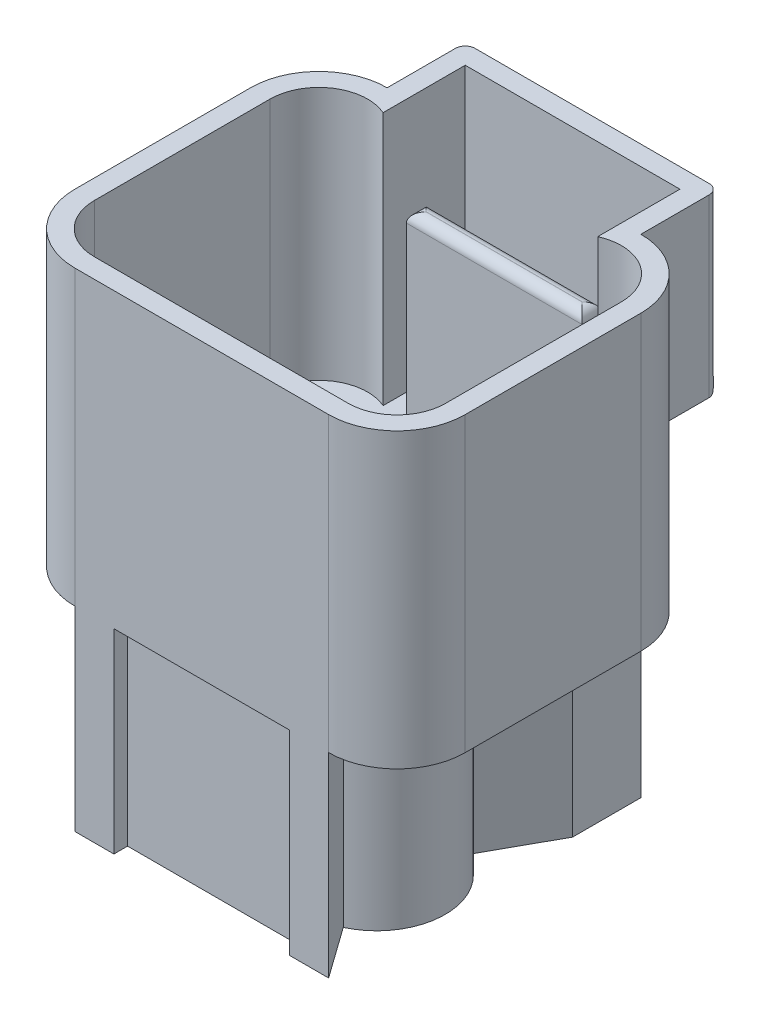
from build123d import *

# Parameters (mm, degrees)
SKETCH_1_W          = 20
SKETCH_1_H          = 15
EXTRUDE_1_DEPTH     = 16
FILLET_1_R          = 3.5
SKETCH_2_W          = 13
SKETCH_2_H          = 9
EXTRUDE_2_DEPTH     = 4
FILLET_2_R          = 0.5
EXTRUDE_3_DEPTH     = 10
SKETCH_4_W          = 9
SKETCH_4_H          = 10
CUT_EXTRUDE_2_DEPTH = 0.7
SKETCH_5_R          = 4.120834068
CUT_EXTRUDE_3_DEPTH = 1
CUT_EXTRUDE_5_DEPTH = 13
SKETCH_7_W          = 9
SKETCH_7_H          = 1.011185769
EXTRUDE_4_DEPTH     = 9
FILLET_3_R          = 0.5
CUT_EXTRUDE_6_DEPTH = 9


with BuildPart() as part:
    # ｽｹｯﾁ1 → ﾎﾞｽ - 押し出し1 (new body)
    with BuildSketch(Plane.XY):
        with Locations((10, 7.5)):
            Rectangle(SKETCH_1_W, SKETCH_1_H)
    extrude(amount=EXTRUDE_1_DEPTH)

    # ﾌｨﾚｯﾄ1
    fillet_1_edges = [part.edges().sort_by_distance(p)[0] for p in [
        (20, 7.5, 16),
        (0, 7.5, 16),
        (20, 7.5, 0),
        (0, 7.5, 0),
    ]]
    fillet(fillet_1_edges, radius=FILLET_1_R)

    # ｽｹｯﾁ2 → ﾎﾞｽ - 押し出し2 (add)
    with BuildSketch(Plane(origin=(0, 0, 0), x_dir=(-1, 0, 0), z_dir=(0, 0, -1))):
        with Locations((-10, 10.5)):
            Rectangle(SKETCH_2_W, SKETCH_2_H)
    extrude(amount=EXTRUDE_2_DEPTH)

    # ﾌｨﾚｯﾄ2
    fillet_2_edges = [part.edges().sort_by_distance(p)[0] for p in [
        (16.5, 10.5, -4),
        (10, 6, -4),
        (3.5, 10.5, -4),
    ]]
    fillet(fillet_2_edges, radius=FILLET_2_R)

    # ｽｹｯﾁ3 → ﾎﾞｽ - 押し出し3 (add)
    with BuildSketch(Plane.XZ):
        with BuildLine():
            Line((3.5, 16), (5.627627053, 13.041328389))
            ThreePointArc((5.627627053, 13.041328389), (4.172978297, 10.083248698), (5.821248207, 7.228525459))
            Line((5.821248207, 7.228525459), (3.5, 3.5))
            Line((3.5, 3.5), (3.5, 0))
            Line((3.5, 0), (16.5, 0))
            Line((16.5, 0), (16.5, 3.5))
            Line((16.5, 3.5), (14.565352324, 6.9904115))
            ThreePointArc((14.565352324, 6.9904115), (16.668731913, 10.163952157), (14.630738056, 13.379873028))
            Line((14.630738056, 13.379873028), (16.5, 16))
            Line((16.5, 16), (3.5, 16))
        make_face()
    extrude(amount=EXTRUDE_3_DEPTH)

    # ｽｹｯﾁ4 → ｶｯﾄ - 押し出し2 (cut)
    with BuildSketch(Plane.XY.offset(16)):
        with Locations((10, -5)):
            Rectangle(SKETCH_4_W, SKETCH_4_H)
    extrude(amount=-CUT_EXTRUDE_2_DEPTH, mode=Mode.SUBTRACT)

    # ｽｹｯﾁ5 → ｶｯﾄ - 押し出し3 (cut)
    with BuildSketch(Plane.XZ.offset(10)):
        with Locations(Location((10, 10.403392153, 0), (0, 0, 270))):
            Circle(SKETCH_5_R)
    extrude(amount=-CUT_EXTRUDE_3_DEPTH, mode=Mode.SUBTRACT)

    # ｽｹｯﾁ6 → ｶｯﾄ - 押し出し5 (cut)
    with BuildSketch(Plane(origin=(0, 15, 0), x_dir=(1, 0, 0), z_dir=(0, 1, 0))):
        with BuildLine():
            Line((15.5, 3), (4.5, 3))
            Line((4.5, 3), (4.5, -1.208712153))
            ThreePointArc((4.5, -1.208712153), (2.130693606, -1.408349934), (1, -3.5))
            Line((1, -3.5), (1, -12.5))
            ThreePointArc((1, -12.5), (1.732233047, -14.267766953), (3.5, -15))
            Line((3.5, -15), (16.5, -15))
            ThreePointArc((16.5, -15), (18.267766953, -14.267766953), (19, -12.5))
            Line((19, -12.5), (19, -3.5))
            ThreePointArc((19, -3.5), (17.869306394, -1.408349934), (15.5, -1.208712153))
            Line((15.5, -1.208712153), (15.5, 3))
        make_face()
    extrude(amount=-CUT_EXTRUDE_5_DEPTH, mode=Mode.SUBTRACT)

    # ｽｹｯﾁ7 → ﾎﾞｽ - 押し出し4 (add)
    with BuildSketch(Plane(origin=(0, 2, 0), x_dir=(1, 0, 0), z_dir=(0, 1, 0))):
        with Locations((10, -0.505592885)):
            Rectangle(SKETCH_7_W, SKETCH_7_H)
    extrude(amount=EXTRUDE_4_DEPTH)

    # ﾌｨﾚｯﾄ3
    fillet_3_edges = [part.edges().sort_by_distance(p)[0] for p in [
        (5.5, 11, 0.505592885),
        (10, 11, 1.011185769),
        (14.5, 11, 0.505592885),
        (10, 11, 0),
    ]]
    fillet(fillet_3_edges, radius=FILLET_3_R)

    # ｽｹｯﾁ8 → ｶｯﾄ - 押し出し6 (cut)
    with BuildSketch(Plane.XZ.offset(10)):
        with BuildLine():
            Line((4.5, 1), (4.5, 0))
            Line((4.5, 0), (5.838412619, 0))
            Line((5.838412619, 0), (5.838412619, 1))
            Line((5.838412619, 1), (14.187040515, 1))
            Line((14.187040515, 1), (14.187040515, 0))
            Line((14.187040515, 0), (15.5, 0))
            Line((15.5, 0), (15.5, 1))
            Line((15.5, 1), (15.5, 3.241396329))
            Line((15.5, 3.241396329), (13.566856979, 6.729093192))
            ThreePointArc((13.566856979, 6.729093192), (10.11032626, 5.283746689), (6.594740038, 6.578846932))
            Line((6.594740038, 6.578846932), (4.5, 3.214152221))
            Line((4.5, 3.214152221), (4.5, 1))
        make_face()
    extrude(amount=-CUT_EXTRUDE_6_DEPTH, mode=Mode.SUBTRACT)


solid = part.part
